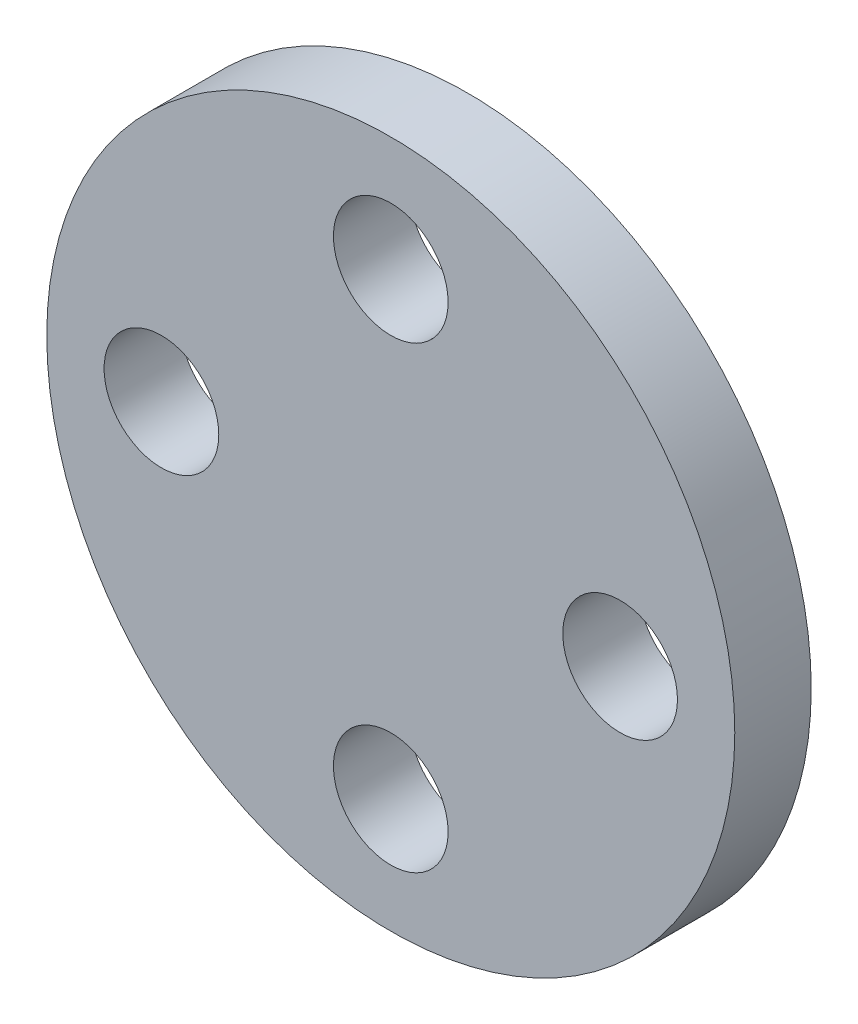
from build123d import *

# Parameters (mm, degrees)
SKETCH1_R           = 14.2875
SKETCH1_R_2         = 2.38125
BOSS_EXTRUDE1_DEPTH = 3.175


with BuildPart() as part:
    # Sketch1 → Boss-Extrude1 (new body)
    with BuildSketch(Plane.XY):
        Circle(SKETCH1_R)
        with Locations((0, 9.525)):
            Circle(SKETCH1_R_2, mode=Mode.SUBTRACT)
        with Locations((9.525, 0)):
            Circle(SKETCH1_R_2, mode=Mode.SUBTRACT)
        with Locations((0, -9.525)):
            Circle(SKETCH1_R_2, mode=Mode.SUBTRACT)
        with Locations((-9.525, 0)):
            Circle(SKETCH1_R_2, mode=Mode.SUBTRACT)
    extrude(amount=BOSS_EXTRUDE1_DEPTH)


solid = part.part
